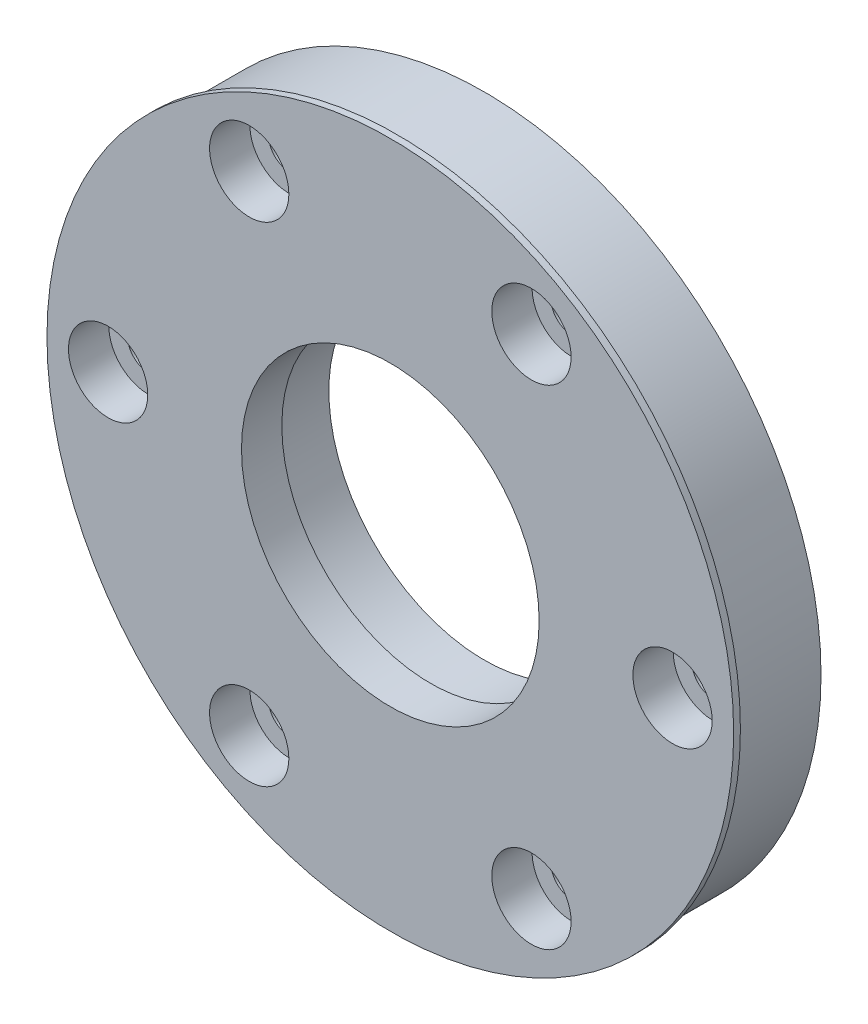
from build123d import *

# Parameters (mm, degrees)
SKETCH2_R                           = 25.05
BOSS_EXTRUDE1_DEPTH                 = 7
SKETCH3_R                           = 2.95
DOWEL_PIN_CUTOUT_DEPTH              = 3
MAIN_START                          = -0.5
SKETCH4_R                           = 25.55
SKETCH4_R_2                         = 25.05
MAIN_HOUSING_BEARING_RETAINER_DEPTH = 0.5
SKETCH5_R                           = 1.55
M3_THRU_DEPTH                       = 37.804958905
SKETCH6_R                           = 3
M3_BUTTON_HEAD_CUTOUT_DEPTH         = 1.7
SKETCH8_R                           = 11.575
INPUT_SHAFT_BEARING_CUTOUT_DEPTH    = 37.804958905
INPUT_START                         = -7
SKETCH9_R                           = 11.575
SKETCH9_R_2                         = 11.075
INPUT_SHAFT_BEARING_RETAINER_DEPTH  = 3


with BuildPart() as part:
    # Sketch2 → Boss-Extrude1 (new body)
    with BuildSketch(Plane.XY):
        Circle(SKETCH2_R)
    extrude(amount=BOSS_EXTRUDE1_DEPTH)

    # Sketch3 → Dowel Pin Cutout (cut)
    with BuildSketch(Plane.XY.offset(7)):
        with Locations((-21, 0)):
            Circle(SKETCH3_R)
        with Locations((-10.5, 18.186533479)):
            Circle(SKETCH3_R)
        with Locations((10.5, 18.186533479)):
            Circle(SKETCH3_R)
        with Locations((21, 0)):
            Circle(SKETCH3_R)
        with Locations((10.5, -18.186533479)):
            Circle(SKETCH3_R)
        with Locations((-10.5, -18.186533479)):
            Circle(SKETCH3_R)
    extrude(amount=-DOWEL_PIN_CUTOUT_DEPTH, mode=Mode.SUBTRACT)

    # Sketch4 → Main Housing Bearing Retainer (add)
    with BuildSketch(Plane.XY.offset(7).offset(MAIN_START)):
        Circle(SKETCH4_R)
        Circle(SKETCH4_R_2, mode=Mode.SUBTRACT)
    extrude(amount=MAIN_HOUSING_BEARING_RETAINER_DEPTH)

    # Sketch5 → M3 Thru (cut, through all)
    with BuildSketch(Plane(origin=(0, 0, 0), x_dir=(-1, 0, 0), z_dir=(0, 0, -1))):
        with Locations((-21, 0)):
            Circle(SKETCH5_R)
        with Locations((-10.5, 18.186533479)):
            Circle(SKETCH5_R)
        with Locations((10.5, 18.186533479)):
            Circle(SKETCH5_R)
        with Locations((21, 0)):
            Circle(SKETCH5_R)
        with Locations((10.5, -18.186533479)):
            Circle(SKETCH5_R)
        with Locations((-10.5, -18.186533479)):
            Circle(SKETCH5_R)
    extrude(amount=-M3_THRU_DEPTH, mode=Mode.SUBTRACT)

    # Sketch6 → M3 Button Head Cutout (cut)
    with BuildSketch(Plane(origin=(0, 0, 0), x_dir=(-1, 0, 0), z_dir=(0, 0, -1))):
        with Locations((-21, 0)):
            Circle(SKETCH6_R)
        with Locations((-10.5, 18.186533479)):
            Circle(SKETCH6_R)
        with Locations((10.5, 18.186533479)):
            Circle(SKETCH6_R)
        with Locations((21, 0)):
            Circle(SKETCH6_R)
        with Locations((10.5, -18.186533479)):
            Circle(SKETCH6_R)
        with Locations((-10.5, -18.186533479)):
            Circle(SKETCH6_R)
    extrude(amount=-M3_BUTTON_HEAD_CUTOUT_DEPTH, mode=Mode.SUBTRACT)

    # Sketch8 → Input Shaft Bearing Cutout (cut, through all)
    with BuildSketch(Plane.XY.offset(7)):
        Circle(SKETCH8_R)
    extrude(amount=-INPUT_SHAFT_BEARING_CUTOUT_DEPTH, mode=Mode.SUBTRACT)

    # Sketch9 → Input Shaft Bearing Retainer (add)
    with BuildSketch(Plane(origin=(0, 0, 0), x_dir=(-1, 0, 0), z_dir=(0, 0, -1)).offset(INPUT_START)):
        with Locations(Location((0, 0, 0), (0, 0, 180))):
            Circle(SKETCH9_R)
        with Locations(Location((0, 0, 0), (0, 0, 180))):
            Circle(SKETCH9_R_2, mode=Mode.SUBTRACT)
    extrude(amount=INPUT_SHAFT_BEARING_RETAINER_DEPTH)


solid = part.part
